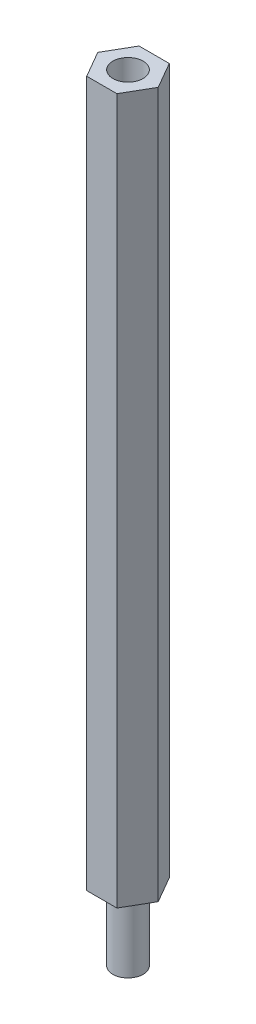
from build123d import *

# Parameters (mm, degrees)
BOSS_EXTRUDE1_DEPTH = 70
SKETCH2_R           = 1.5
CUT_EXTRUDE1_DEPTH  = 20
SKETCH3_R           = 1.5
BOSS_EXTRUDE2_DEPTH = 7


with BuildPart() as part:
    # Sketch1 → Boss-Extrude1 (new body)
    with BuildSketch(Plane(origin=(0, 0, 0), x_dir=(1, 0, 0), z_dir=(0, 1, 0))):
        Polygon((3, 0), (1.5, 2.598076211), (-1.5, 2.598076211), (-3, 0), (-1.5, -2.598076211), (1.5, -2.598076211), align=None)
    extrude(amount=BOSS_EXTRUDE1_DEPTH)

    # Sketch2 → Cut-Extrude1 (cut)
    with BuildSketch(Plane(origin=(0, 70, 0), x_dir=(1, 0, 0), z_dir=(0, 1, 0))):
        with Locations(Location((0, 0, 0), (0, 0, 270))):
            Circle(SKETCH2_R)
    extrude(amount=-CUT_EXTRUDE1_DEPTH, mode=Mode.SUBTRACT)

    # Sketch3 → Boss-Extrude2 (add)
    with BuildSketch(Plane(origin=(0, 0, 0), x_dir=(-1, 0, 0), z_dir=(0, -1, 0))):
        with Locations(Location((0, 0, 0), (0, 0, 270))):
            Circle(SKETCH3_R)
    extrude(amount=BOSS_EXTRUDE2_DEPTH)


solid = part.part
